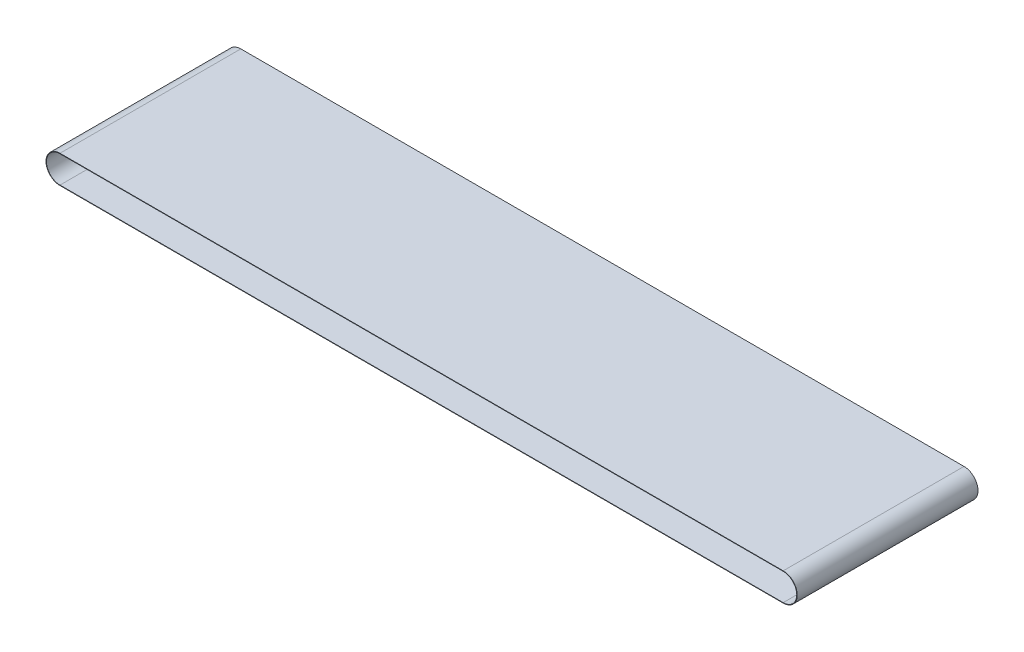
from build123d import *

# Parameters (mm, degrees)
BOSS_EXTRUDE1_DEPTH = 250


with BuildPart() as part:
    # Sketch1 → Boss-Extrude1 (new, symmetric)
    with BuildSketch(Plane.XY):
        with BuildLine():
            Line((0, -38.7), (2000, -38.7))
            ThreePointArc((2000, -38.7), (2038.7, 0), (2000, 38.7))
            Line((2000, 38.7), (0, 38.7))
            ThreePointArc((0, 38.7), (-38.7, 0), (0, -38.7))
        make_face()
        with BuildLine():
            Line((0, 37.5), (2000, 37.5))
            ThreePointArc((2000, 37.5), (2037.5, 0), (2000, -37.5))
            Line((2000, -37.5), (0, -37.5))
            ThreePointArc((0, -37.5), (-37.5, 0), (0, 37.5))
        make_face(mode=Mode.SUBTRACT)
    extrude(amount=BOSS_EXTRUDE1_DEPTH, both=True)


solid = part.part
